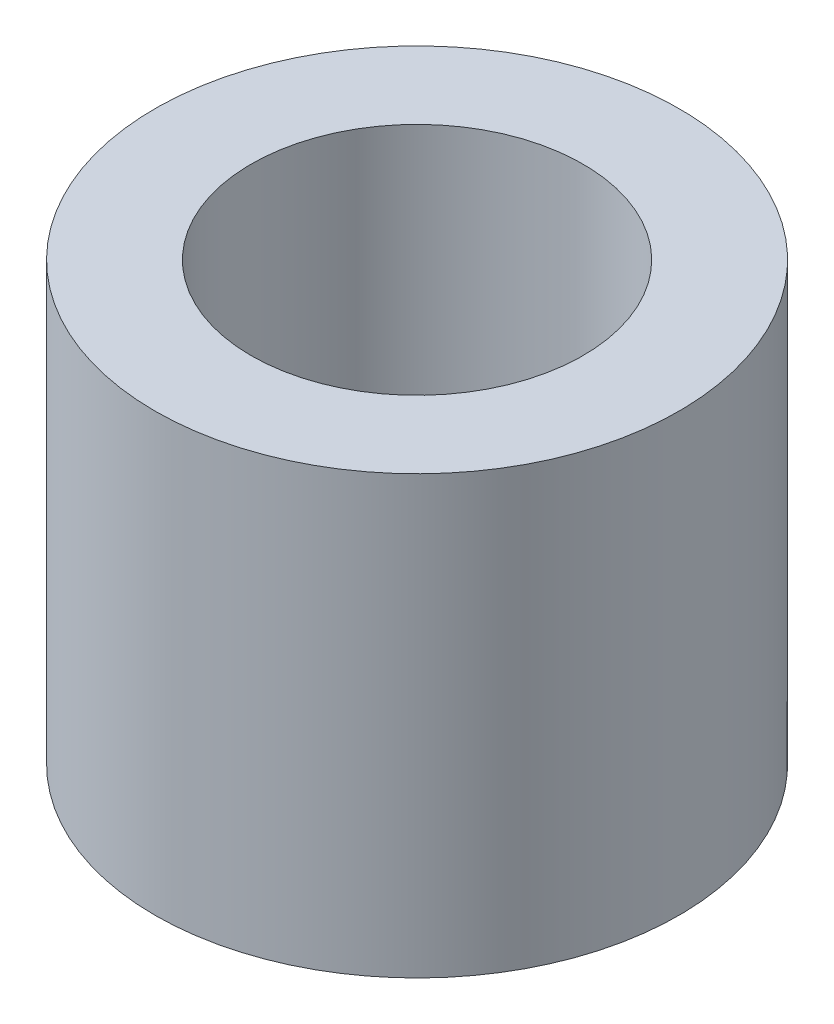
from build123d import *

# Parameters (mm, degrees)
SKETCH1_R           = 3
SKETCH1_R_2         = 1.9
BOSS_EXTRUDE1_DEPTH = 5


with BuildPart() as part:
    # Sketch1 → Boss-Extrude1 (new body)
    with BuildSketch(Plane(origin=(0, 0, 0), x_dir=(1, 0, 0), z_dir=(0, 1, 0))):
        with Locations(Location((0, 0, 0), (0, 0, 270))):
            Circle(SKETCH1_R)
        with Locations(Location((0, 0, 0), (0, 0, 270))):
            Circle(SKETCH1_R_2, mode=Mode.SUBTRACT)
    extrude(amount=BOSS_EXTRUDE1_DEPTH)


solid = part.part
